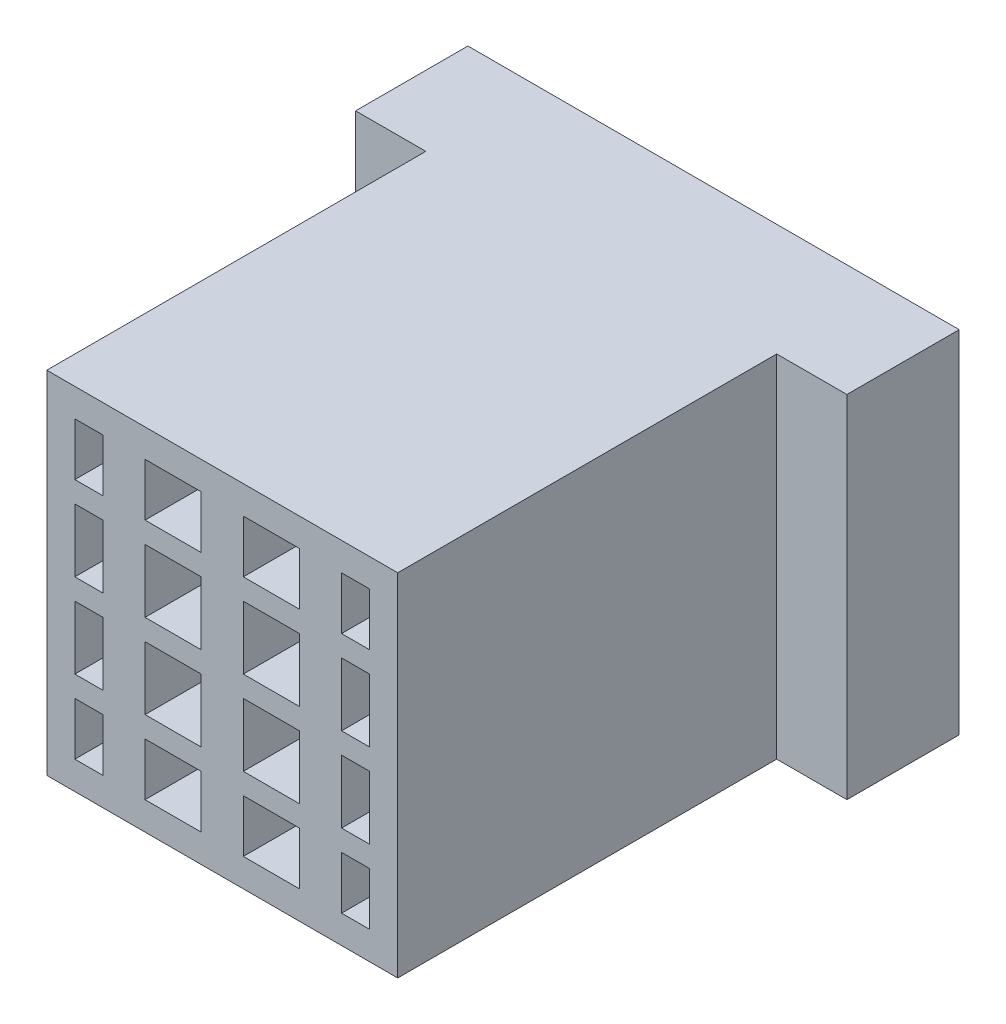
from build123d import *

# Parameters (mm, degrees)
SKETCH_8_W          = 25
SKETCH_8_H          = 25
SKETCH_8_W_2        = 4
SKETCH_8_H_2        = 21
SKETCH_8_W_3        = 2
EXTRUDE_7_DEPTH     = 25
SKETCH_9_W          = 25
SKETCH_9_H          = 25
EXTRUDE_8_DEPTH     = 2
SKETCH_11_W         = 35
SKETCH_11_H         = 25
EXTRUDE_9_DEPTH     = 6
SKETCH_12_W         = 30
SKETCH_12_H         = 21
CUT_EXTRUDE_1_DEPTH = 4
SKETCH_14_W         = 25
SKETCH_14_H         = 1.5
EXTRUDE_11_DEPTH    = 25
SKETCH_15_W         = 35
SKETCH_15_H         = 25
EXTRUDE_12_DEPTH    = 2


with BuildPart() as part:
    # 草图8 → 凸台-拉伸7 (new body)
    with BuildSketch(Plane.XY):
        Rectangle(SKETCH_8_W, SKETCH_8_H)
        with Locations((3.5, 0)):
            Rectangle(SKETCH_8_W_2, SKETCH_8_H_2, mode=Mode.SUBTRACT)
        with Locations((-3.5, 0)):
            Rectangle(SKETCH_8_W_2, SKETCH_8_H_2, mode=Mode.SUBTRACT)
        with Locations((-9.5, 0)):
            Rectangle(SKETCH_8_W_3, SKETCH_8_H_2, mode=Mode.SUBTRACT)
        with Locations((9.5, 0)):
            Rectangle(SKETCH_8_W_3, SKETCH_8_H_2, mode=Mode.SUBTRACT)
    extrude(amount=EXTRUDE_7_DEPTH)

    # 草图9 → 凸台-拉伸8 (add)
    with BuildSketch(Plane(origin=(0, 0, 0), x_dir=(-1, 0, 0), z_dir=(0, 0, -1))):
        Rectangle(SKETCH_9_W, SKETCH_9_H)
    extrude(amount=EXTRUDE_8_DEPTH)

    # 草图11 → 凸台-拉伸9 (add)
    with BuildSketch(Plane(origin=(0, 0, -2), x_dir=(-1, 0, 0), z_dir=(0, 0, -1))):
        Rectangle(SKETCH_11_W, SKETCH_11_H)
    extrude(amount=EXTRUDE_9_DEPTH)

    # 草图12 → 切除-拉伸1 (cut)
    with BuildSketch(Plane(origin=(0, 0, -8), x_dir=(-1, 0, 0), z_dir=(0, 0, -1))):
        Rectangle(SKETCH_12_W, SKETCH_12_H)
    extrude(amount=-CUT_EXTRUDE_1_DEPTH, mode=Mode.SUBTRACT)

    # 草图14 → 凸台-拉伸11 (add)
    with BuildSketch(Plane.XY.offset(25)):
        Rectangle(SKETCH_14_W, SKETCH_14_H)
        with Locations((0, 6)):
            Rectangle(SKETCH_14_W, SKETCH_14_H)
        with Locations((0, -6)):
            Rectangle(SKETCH_14_W, SKETCH_14_H)
    extrude(amount=-EXTRUDE_11_DEPTH)

    # 草图15 → 凸台-拉伸12 (add)
    with BuildSketch(Plane(origin=(0, 0, -8), x_dir=(-1, 0, 0), z_dir=(0, 0, -1))):
        Rectangle(SKETCH_15_W, SKETCH_15_H)
    extrude(amount=EXTRUDE_12_DEPTH)


solid = part.part
